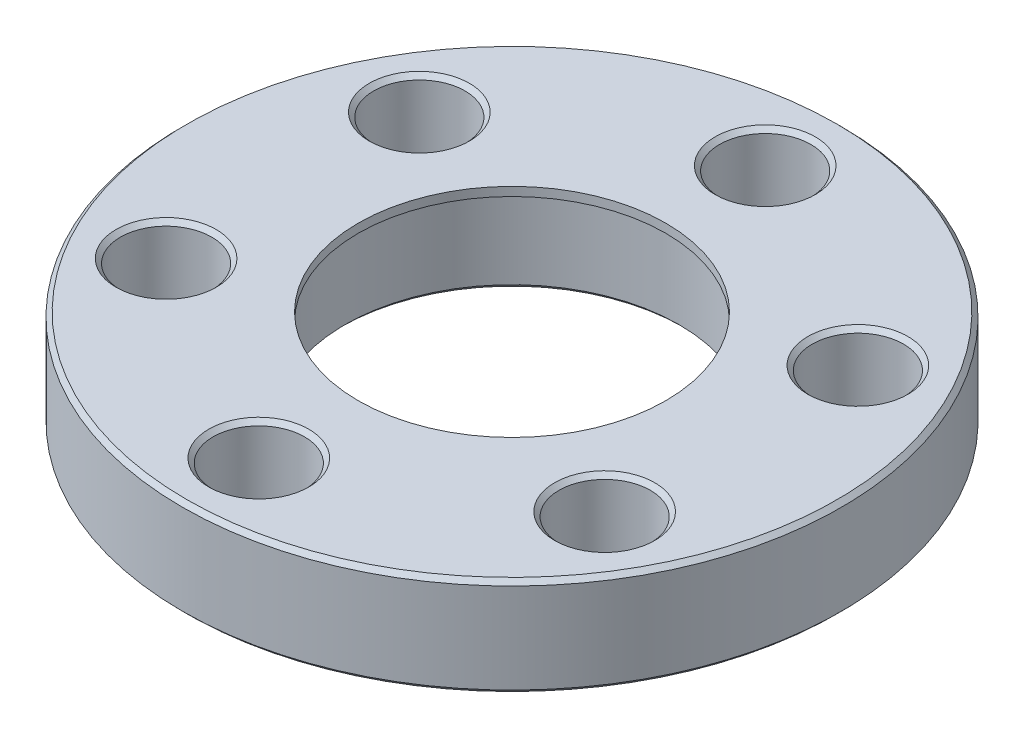
from build123d import *

# Parameters (mm, degrees)
SKETCH_1_R          = 15
SKETCH_1_R_2        = 7
SKETCH_1_R_3        = 2.08
EXTRUDE_1_DEPTH     = 3.1
EXTRUDE_START       = 1.4
SKETCH_2_R          = 15
SKETCH_2_R_2        = 7
SKETCH_2_R_3        = 0.9
EXTRUDE_2_DEPTH     = 1.4
SKETCH_3_R          = 7.6
CUT_EXTRUDE_1_DEPTH = 4.1
CHAMFER_1_SIZE      = 0.2
CHAMFER_2_SIZE      = 0.3


with BuildPart() as part:
    # 草图1 → 凸台-拉伸1 (new body)
    with BuildSketch(Plane(origin=(0, 0, 0), x_dir=(1, 0, 0), z_dir=(0, 1, 0))):
        with Locations(Location((0, 0, 0), (0, 0, 90))):
            Circle(SKETCH_1_R)
        with Locations(Location((0, 0, 0), (0, 0, 90))):
            Circle(SKETCH_1_R_2, mode=Mode.SUBTRACT)
        with Locations(Location((0, 11.525, 0), (0, 0, 90))):
            Circle(SKETCH_1_R_3, mode=Mode.SUBTRACT)
        with Locations(Location((9.980942779, 5.7625, 0), (0, 0, 90))):
            Circle(SKETCH_1_R_3, mode=Mode.SUBTRACT)
        with Locations(Location((9.980942779, -5.7625, 0), (0, 0, 90))):
            Circle(SKETCH_1_R_3, mode=Mode.SUBTRACT)
        with Locations(Location((0, -11.525, 0), (0, 0, 90))):
            Circle(SKETCH_1_R_3, mode=Mode.SUBTRACT)
        with Locations(Location((-9.980942779, -5.7625, 0), (0, 0, 90))):
            Circle(SKETCH_1_R_3, mode=Mode.SUBTRACT)
        with Locations(Location((-9.980942779, 5.7625, 0), (0, 0, 90))):
            Circle(SKETCH_1_R_3, mode=Mode.SUBTRACT)
    extrude(amount=EXTRUDE_1_DEPTH)

    # 草图2 → 凸台-拉伸2 (add)
    with BuildSketch(Plane(origin=(0, 0, 0), x_dir=(-1, 0, 0), z_dir=(0, -1, 0)).offset(EXTRUDE_START)):
        with Locations(Location((0, 0, 0), (0, 0, 90))):
            Circle(SKETCH_2_R)
        with Locations(Location((0, 0, 0), (0, 0, 90))):
            Circle(SKETCH_2_R_2, mode=Mode.SUBTRACT)
        with Locations(Location((0, 11.53, 0), (0, 0, 90))):
            Circle(SKETCH_2_R_3, mode=Mode.SUBTRACT)
        with Locations(Location((9.985272906, 5.765, 0), (0, 0, 90))):
            Circle(SKETCH_2_R_3, mode=Mode.SUBTRACT)
        with Locations(Location((9.985272906, -5.765, 0), (0, 0, 90))):
            Circle(SKETCH_2_R_3, mode=Mode.SUBTRACT)
        with Locations(Location((0, -11.53, 0), (0, 0, 90))):
            Circle(SKETCH_2_R_3, mode=Mode.SUBTRACT)
        with Locations(Location((-9.985272906, -5.765, 0), (0, 0, 90))):
            Circle(SKETCH_2_R_3, mode=Mode.SUBTRACT)
        with Locations(Location((-9.985272906, 5.765, 0), (0, 0, 90))):
            Circle(SKETCH_2_R_3, mode=Mode.SUBTRACT)
    extrude(amount=-EXTRUDE_2_DEPTH)

    # 草图3 → 切除-拉伸1 (cut)
    with BuildSketch(Plane(origin=(0, -1.4, 0), x_dir=(-1, 0, 0), z_dir=(0, -1, 0))):
        with Locations(Location((0, 0, 0), (0, 0, 90))):
            Circle(SKETCH_3_R)
    extrude(amount=-CUT_EXTRUDE_1_DEPTH, mode=Mode.SUBTRACT)

    # 倒角1
    chamfer_1_edges = [part.edges().sort_by_distance(p)[0] for p in [
        (9.980942779, 3.1, -3.6825),
        (9.980942779, 3.1, 7.8425),
        (0, 3.1, 13.605),
        (-9.980942779, 3.1, 7.8425),
        (-9.980942779, 3.1, -3.6825),
        (0, -1.4, 15),
        (0, -1.4, -10.63),
        (-9.985272906, -1.4, -4.865),
        (-9.985272906, -1.4, 6.665),
        (0, -1.4, 12.43),
        (9.985272906, -1.4, 6.665),
        (9.985272906, -1.4, -4.865),
        (0, 3.1, 15),
        (0, -1.4, 7.6),
        (0, 3.1, -9.445),
    ]]
    chamfer(chamfer_1_edges, length=CHAMFER_1_SIZE)

    # 倒角2
    chamfer_2_edges = [part.edges().sort_by_distance(p)[0] for p in [
        (0, 2.7, 7.6),
    ]]
    chamfer(chamfer_2_edges, length=CHAMFER_2_SIZE)


solid = part.part
